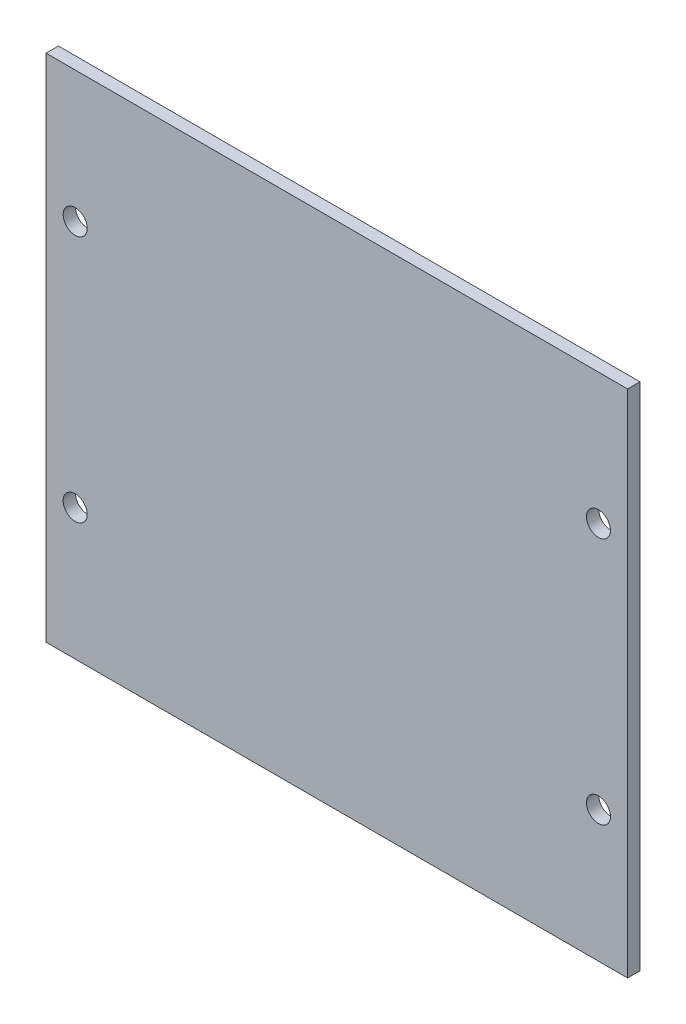
from build123d import *

# Parameters (mm, degrees)
SKETCH1_W           = 79.8
SKETCH1_H           = 70
BOSS_EXTRUDE1_DEPTH = 1.7
SKETCH1_3_W         = 55
SKETCH1_3_H         = 2.5
BOSS_EXTRUDE2_DEPTH = 9.5
SKETCH1_4_R         = 1.65
CUT_EXTRUDE1_DEPTH  = 54.919013344


with BuildPart() as part:
    # Sketch1 → Boss-Extrude1 (new body)
    with BuildSketch(Plane.XY):
        Rectangle(SKETCH1_W, SKETCH1_H)
    extrude(amount=BOSS_EXTRUDE1_DEPTH)

    # Sketch1<3> → Boss-Extrude2 (add)
    with BuildSketch(Plane.XY):
        with Locations((0, -12.7)):
            Rectangle(SKETCH1_3_W, SKETCH1_3_H)
        with Locations((0, 12.7)):
            Rectangle(SKETCH1_3_W, SKETCH1_3_H)
        with Locations((0, -17.7)):
            Rectangle(SKETCH1_3_W, SKETCH1_3_H)
        with Locations((0, 17.7)):
            Rectangle(SKETCH1_3_W, SKETCH1_3_H)
    extrude(amount=-BOSS_EXTRUDE2_DEPTH)

    # Sketch1<4> → Cut-Extrude1 (cut, through all)
    with BuildSketch(Plane.XY):
        with Locations((-35.9, 17)):
            Circle(SKETCH1_4_R)
        with Locations((35.9, 17)):
            Circle(SKETCH1_4_R)
        with Locations((35.9, -17)):
            Circle(SKETCH1_4_R)
        with Locations((-35.9, -17)):
            Circle(SKETCH1_4_R)
    extrude(amount=CUT_EXTRUDE1_DEPTH, mode=Mode.SUBTRACT)


solid = part.part
